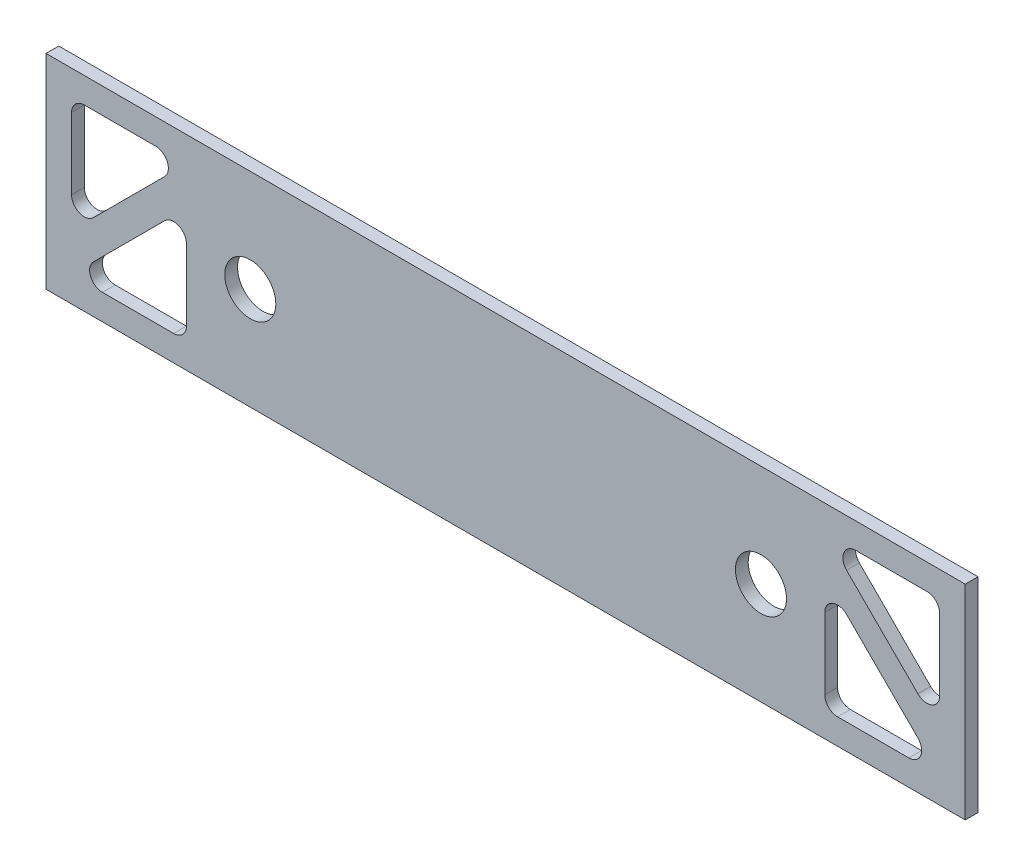
from build123d import *

# Parameters (mm, degrees)
SKETCH1_W           = 6.35
SKETCH1_H           = 101.6
BOSS_EXTRUDE1_DEPTH = 457.2
SKETCH2_R           = 12.7
CUT_EXTRUDE1_DEPTH  = 467.602190566
CUT_EXTRUDE2_DEPTH  = 467.602190566


with BuildPart() as part:
    # Sketch1 → Boss-Extrude1 (new body)
    with BuildSketch(Plane(origin=(0, 0, 0), x_dir=(0, 0, -1), z_dir=(1, 0, 0))):
        with Locations((1.913371748, -42.180867605)):
            Rectangle(SKETCH1_W, SKETCH1_H)
    extrude(amount=BOSS_EXTRUDE1_DEPTH)

    # Sketch2 → Cut-Extrude1 (cut, through all)
    with BuildSketch(Plane(origin=(0, 0, -5.088371748), x_dir=(-1, 0, 0), z_dir=(0, 0, -1))):
        with Locations(Location((-355.6, -42.180867605, 0), (0, 0, 90))):
            Circle(SKETCH2_R)
        with Locations(Location((-101.6, -42.180867605, 0), (0, 0, 90))):
            Circle(SKETCH2_R)
    extrude(amount=-CUT_EXTRUDE1_DEPTH, mode=Mode.SUBTRACT)

    # Sketch3 → Cut-Extrude2 (cut, through all)
    with BuildSketch(Plane(origin=(0, 0, -5.088371748), x_dir=(-1, 0, 0), z_dir=(0, 0, -1))):
        with BuildLine():
            Line((-438.15, -4.080867605), (-402.680256121, -4.080867605))
            ThreePointArc((-402.680256121, -4.080867605), (-396.81362109, -8.000827809), (-398.190128061, -14.920995665))
            Line((-398.190128061, -14.920995665), (-433.659871939, -50.390739544))
            ThreePointArc((-433.659871939, -50.390739544), (-440.580039796, -51.767246515), (-444.5, -45.900611484))
            Line((-444.5, -45.900611484), (-444.5, -10.430867605))
            ThreePointArc((-444.5, -10.430867605), (-442.640128061, -5.940739544), (-438.15, -4.080867605))
        make_face()
        with BuildLine():
            Line((-398.190128061, -33.970995665), (-433.659871939, -69.440739544))
            ThreePointArc((-433.659871939, -69.440739544), (-435.03637891, -76.3609074), (-429.169743879, -80.280867605))
            Line((-429.169743879, -80.280867605), (-393.7, -80.280867605))
            ThreePointArc((-393.7, -80.280867605), (-389.209871939, -78.420995665), (-387.35, -73.930867605))
            Line((-387.35, -73.930867605), (-387.35, -38.461123726))
            ThreePointArc((-387.35, -38.461123726), (-391.269960204, -32.594488694), (-398.190128061, -33.970995665))
        make_face()
        with BuildLine():
            Line((-69.85, -73.930867605), (-69.85, -38.461123726))
            ThreePointArc((-69.85, -38.461123726), (-65.930039796, -32.594488694), (-59.009871939, -33.970995665))
            Line((-59.009871939, -33.970995665), (-23.540128061, -69.440739544))
            ThreePointArc((-23.540128061, -69.440739544), (-22.16362109, -76.3609074), (-28.030256121, -80.280867605))
            Line((-28.030256121, -80.280867605), (-63.5, -80.280867605))
            ThreePointArc((-63.5, -80.280867605), (-67.990128061, -78.420995665), (-69.85, -73.930867605))
        make_face()
        with BuildLine():
            Line((-23.540128061, -50.390739544), (-59.009871939, -14.920995665))
            ThreePointArc((-59.009871939, -14.920995665), (-60.38637891, -8.000827809), (-54.519743879, -4.080867605))
            Line((-54.519743879, -4.080867605), (-19.05, -4.080867605))
            ThreePointArc((-19.05, -4.080867605), (-14.559871939, -5.940739544), (-12.7, -10.430867605))
            Line((-12.7, -10.430867605), (-12.7, -45.900611484))
            ThreePointArc((-12.7, -45.900611484), (-16.619960204, -51.767246515), (-23.540128061, -50.390739544))
        make_face()
    extrude(amount=-CUT_EXTRUDE2_DEPTH, mode=Mode.SUBTRACT)


solid = part.part
